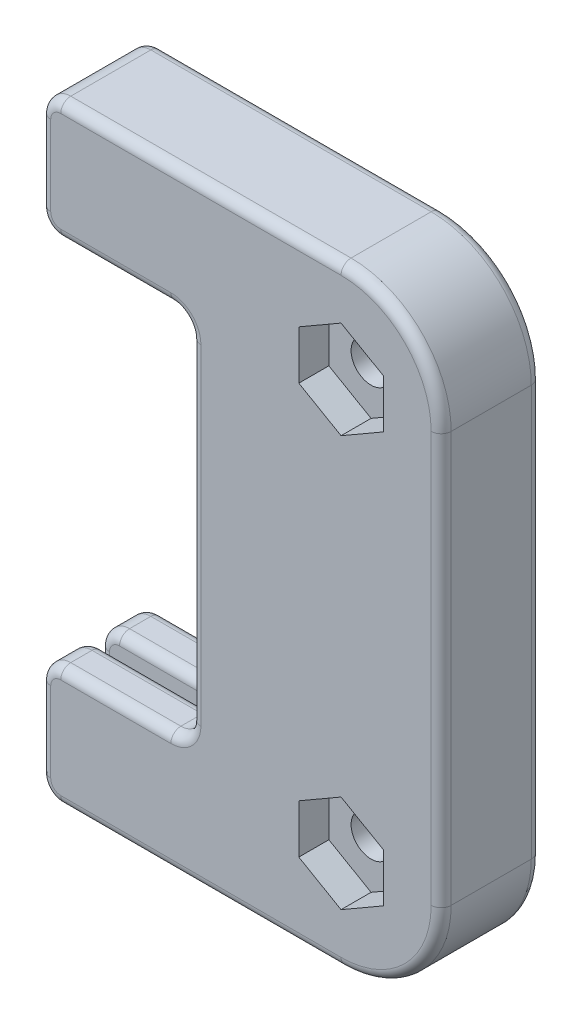
from build123d import *

# Parameters (mm, degrees)
BOSS_EXTRUDE1_DEPTH = 10
SKETCH2_W           = 1.75
SKETCH2_H           = 51.15
CUT_EXTRUDE1_DEPTH  = 20
SKETCH3_R           = 2
CUT_EXTRUDE2_DEPTH  = 10
FILLET1_R           = 10
FILLET2_R           = 2
FILLET3_R           = 1
CUT_EXTRUDE3_DEPTH  = 3


with BuildPart() as part:
    # Sketch1 → Boss-Extrude1 (new body)
    with BuildSketch(Plane.XY):
        Polygon((0, 0), (40, 0), (40, 61), (0, 61), (0, 49), (15, 49), (15, 12), (0, 12), align=None)
    extrude(amount=BOSS_EXTRUDE1_DEPTH)

    # Sketch2 → Cut-Extrude1 (cut)
    with BuildSketch(Plane.ZY):
        with Locations((5, 30.5)):
            Rectangle(SKETCH2_W, SKETCH2_H)
    extrude(amount=-CUT_EXTRUDE1_DEPTH, mode=Mode.SUBTRACT)

    # Sketch3 → Cut-Extrude2 (cut)
    with BuildSketch(Plane.XY.offset(10)):
        with Locations((30, 10)):
            Circle(SKETCH3_R)
        with Locations((30, 51)):
            Circle(SKETCH3_R)
    extrude(amount=-CUT_EXTRUDE2_DEPTH, mode=Mode.SUBTRACT)

    # Fillet1
    fillet1_edges = [part.edges().sort_by_distance(p)[0] for p in [
        (40, 61, 5),
        (40, 0, 5),
    ]]
    fillet(fillet1_edges, radius=FILLET1_R)

    # Fillet2
    fillet2_edges = [part.edges().sort_by_distance(p)[0] for p in [
        (0, 12, 7.9375),
        (15, 12, 7.9375),
        (15, 49, 7.9375),
        (0, 49, 7.9375),
        (0, 61, 5),
        (0, 0, 5),
        (0, 12, 2.0625),
        (15, 12, 2.0625),
        (15, 49, 2.0625),
        (0, 49, 2.0625),
    ]]
    fillet(fillet2_edges, radius=FILLET2_R)

    # Fillet3
    fillet3_edges = [part.edges().sort_by_distance(p)[0] for p in [
        (14.414213562, 48.414213562, 0),
        (14.414213562, 48.414213562, 4.125),
        (14.414213562, 48.414213562, 5.875),
        (14.414213562, 48.414213562, 10),
        (14.414213562, 12.585786438, 0),
        (14.414213562, 12.585786438, 4.125),
        (14.414213562, 12.585786438, 5.875),
        (14.414213562, 12.585786438, 10),
        (0, 56.075, 5),
        (0, 53.5375, 4.125),
        (0, 4.925, 5),
        (0, 7.4625, 5.875),
        (16, 61, 0),
        (16, 61, 10),
        (40, 30.5, 0),
        (37.071067812, 2.928932188, 0),
        (37.071067812, 58.071067812, 0),
        (40, 30.5, 10),
        (37.071067812, 2.928932188, 10),
        (37.071067812, 58.071067812, 10),
        (0, 53.5375, 5.875),
        (0, 55, 10),
        (0, 55, 0),
        (16, 0, 0),
        (0, 6, 0),
        (7.5, 12, 0),
        (15, 30.5, 0),
        (7.5, 49, 0),
        (0.585786438, 0.585786438, 0),
        (0.585786438, 11.414213562, 0),
        (0.585786438, 49.585786438, 0),
        (0.585786438, 60.414213562, 0),
        (7.5, 49, 10),
        (15, 30.5, 10),
        (7.5, 12, 10),
        (0, 6, 10),
        (16, 0, 10),
        (0.585786438, 0.585786438, 10),
        (0.585786438, 11.414213562, 10),
        (0.585786438, 49.585786438, 10),
        (0.585786438, 60.414213562, 10),
        (7.5, 49, 5.875),
        (7.5, 12, 5.875),
        (15, 30.5, 5.875),
        (0.585786438, 11.414213562, 5.875),
        (0.585786438, 49.585786438, 5.875),
        (7.5, 49, 4.125),
        (15, 30.5, 4.125),
        (7.5, 12, 4.125),
        (0, 7.4625, 4.125),
        (0.585786438, 11.414213562, 4.125),
        (0.585786438, 49.585786438, 4.125),
    ]]
    fillet(fillet3_edges, radius=FILLET3_R)

    # Sketch4 → Cut-Extrude3 (cut)
    with BuildSketch(Plane.XY.offset(10)):
        Polygon((30, 46.128607104), (34.21875, 48.564303552), (34.21875, 53.435696448), (30, 55.871392896), (25.78125, 53.435696448), (25.78125, 48.564303552), align=None)
        Polygon((30, 5.128607104), (34.21875, 7.564303552), (34.21875, 12.435696448), (30, 14.871392896), (25.78125, 12.435696448), (25.78125, 7.564303552), align=None)
    extrude(amount=-CUT_EXTRUDE3_DEPTH, mode=Mode.SUBTRACT)


solid = part.part
